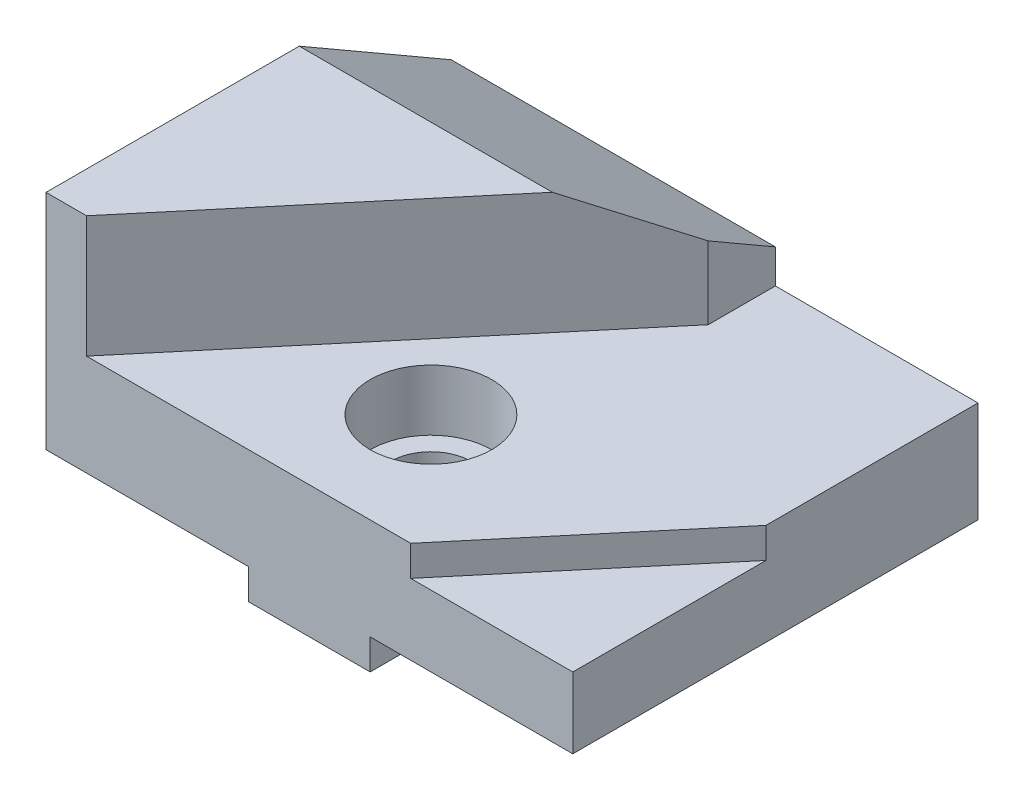
from build123d import *

# Parameters (mm, degrees)
BOSS_EXTRU_1_DEPTH                               = 63.5
CHANFREIN1_SIZE                                  = 23.8125
CHANFREIN1_SIZE2                                 = 13.748153285
ENL_V_MAT_EXTRU_1_DEPTH                          = 19.05
CHAMBRAGE_POUR_VIS_T_TE_RONDE_BOMB_E_D           = 12.7
CHAMBRAGE_POUR_VIS_T_TE_RONDE_BOMB_E_CBORE_D     = 19.05
CHAMBRAGE_POUR_VIS_T_TE_RONDE_BOMB_E_CBORE_DEPTH = 9.525
ENL_V_MAT_EXTRU_2_DEPTH                          = 4.7625


with BuildPart() as part:
    # Esquisse1 → Boss.-Extru.1 (new body)
    with BuildSketch(Plane.XY):
        Polygon((0, 0), (31.75, 0), (31.75, -4.7625), (50.8, -4.7625), (50.8, 0), (82.55, 0), (82.55, 34.925), (0, 34.925), align=None)
    extrude(amount=BOSS_EXTRU_1_DEPTH)

    # Chanfrein1
    chanfrein1_edges = [part.edges().sort_by_distance(p)[0] for p in [
        (41.275, 34.925, 0),
    ]]
    chanfrein1_side = [part.faces().sort_by_distance(p)[0] for p in [
        (41.275, 34.925, 31.75),
    ]]
    chamfer(chanfrein1_edges, length=CHANFREIN1_SIZE, length2=CHANFREIN1_SIZE2, reference=chanfrein1_side[0])

    # Esquisse2 → Enlèv. mat.-Extru.1 (cut)
    with BuildSketch(Plane(origin=(0, 34.925, 0), x_dir=(1, 0, 0), z_dir=(0, 1, 0))):
        Polygon((50.8, 0), (50.8, -10.526552809), (6.35, -63.5), (82.55, -63.5), (82.55, 0), align=None)
    extrude(amount=-ENL_V_MAT_EXTRU_1_DEPTH, mode=Mode.SUBTRACT)

    # Chambrage pour vis à tête ronde bombée #01 (through all)
    with Locations(Plane(origin=(0, 15.875, 0), x_dir=(1, 0, 0), z_dir=(0, 1, 0))):
        with Locations((41.275, -44.45)):
            CounterBoreHole(CHAMBRAGE_POUR_VIS_T_TE_RONDE_BOMB_E_D / 2, CHAMBRAGE_POUR_VIS_T_TE_RONDE_BOMB_E_CBORE_D / 2, CHAMBRAGE_POUR_VIS_T_TE_RONDE_BOMB_E_CBORE_DEPTH)

    # Esquisse5 → Enlèv. mat.-Extru.2 (cut)
    with BuildSketch(Plane(origin=(0, 15.875, 0), x_dir=(1, 0, 0), z_dir=(0, 1, 0))):
        Polygon((57.15, -63.5), (82.55, -63.5), (82.55, -33.229458748), align=None)
    extrude(amount=-ENL_V_MAT_EXTRU_2_DEPTH, mode=Mode.SUBTRACT)


solid = part.part
